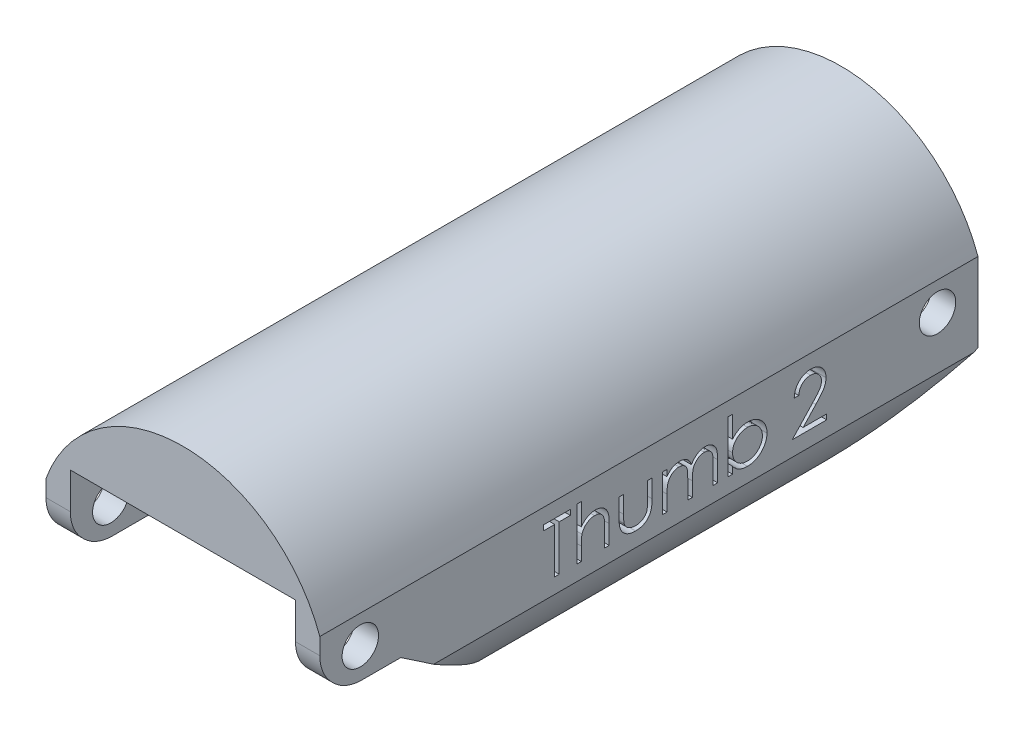
from build123d import *

# Parameters (mm, degrees)
BOSS_EXTRUDE1_DEPTH     = 20.6375
CUT_EXTRUDE1_DEPTH      = 30.060266989
CUT_EXTRUDE2_DEPTH      = 47.067541026
BOSS_EXTRUDE2_DEPTH     = 17.1704
SKETCH7_W               = 2.54
SKETCH7_H               = 2.8575
CUT_EXTRUDE3_DEPTH      = 2.54
SKETCH9_W               = 2.54
SKETCH9_H               = 3.81
CUT_EXTRUDE5_DEPTH      = 29.284043376
SKETCH11_W              = 2.54
SKETCH11_H              = 3.81
CUT_EXTRUDE8_DEPTH      = 3.81
CUT_EXTRUDE9_DEPTH      = 1.016
SKETCH13_W              = 3.556
SKETCH13_H              = 7.809132178
CUT_EXTRUDE10_DEPTH     = 3.81
SKETCH14_W              = 3.556
SKETCH14_H              = 6.35
CUT_EXTRUDE11_DEPTH     = 30.70423848
SKETCH10_R              = 0.889
CUT_EXTRUDE7_DEPTH      = 30.060266989
MIRROR4_COPY_1_SKETCH_W = 2.54
MIRROR4_COPY_1_SKETCH_H = 2.8575
MIRROR4_COPY_1_DEPTH    = 2.54
MIRROR4_COPY_2_SKETCH_W = 2.54
MIRROR4_COPY_2_SKETCH_H = 3.81
MIRROR4_COPY_2_DEPTH    = 29.284043376
MIRROR4_COPY_3_SKETCH_W = 2.54
MIRROR4_COPY_3_SKETCH_H = 3.81
MIRROR4_COPY_3_DEPTH    = 3.81
MIRROR4_COPY_4_DEPTH    = 1.016
MIRROR4_COPY_5_SKETCH_W = 3.556
MIRROR4_COPY_5_SKETCH_H = 7.809132178
MIRROR4_COPY_5_DEPTH    = 3.81
MIRROR4_COPY_6_SKETCH_W = 3.556
MIRROR4_COPY_6_SKETCH_H = 6.35
MIRROR4_COPY_6_DEPTH    = 30.70423848
CUT_EXTRUDE12_START     = -17.1704
CUT_EXTRUDE12_DEPTH     = 17.1704
SKETCH16_R              = 1.143
CUT_EXTRUDE13_DEPTH     = 30.060266989
CUT_EXTRUDE14_DEPTH     = 30.060266989
FILLET1_R               = 2.54
SKETCH21_W              = 14.1224
SKETCH21_H              = 7.62
CUT_EXTRUDE17_DEPTH     = 7.809132178
CUT_EXTRUDE18_START     = -1.184421
SKETCH22_W              = 7.0104
SKETCH22_H              = 2.54
CUT_EXTRUDE18_DEPTH     = 1.184421
SKETCH23_W              = 14.1224
SKETCH23_H              = 7.62
CUT_EXTRUDE19_DEPTH     = 0.1425
CUT_EXTRUDE20_DEPTH     = 16.51
SKETCH25_W              = 14.1224
SKETCH25_H              = 7.62
CUT_EXTRUDE21_DEPTH     = 6.623962162
CUT_EXTRUDE22_DEPTH     = 16.51
BOSS_EXTRUDE3_DEPTH     = 41.275
CUT_EXTRUDE24_START     = -33.382648
CUT_EXTRUDE24_DEPTH     = 33.858391
CUT_EXTRUDE23_DEPTH     = 1


with BuildPart() as part:
    # Sketch1 → Boss-Extrude1 (new, symmetric)
    with BuildSketch(Plane.XY):
        with BuildLine():
            Line((0, 0), (0, 5.08))
            ThreePointArc((0, 5.08), (8.5852, 11.1252), (17.1704, 5.08))
            Line((17.1704, 5.08), (17.1704, 0))
            ThreePointArc((17.1704, 0), (8.5852, -6.0452), (0, 0))
        make_face()
    extrude(amount=BOSS_EXTRUDE1_DEPTH, both=True)

    # Sketch2 → Cut-Extrude1 (cut, through all)
    with BuildSketch(Plane(origin=(0, 0, 0), x_dir=(0, 0, -1), z_dir=(1, 0, 0))):
        Polygon((-20.6375, -6.0452), (-20.6375, 0.635), (-3.81, -6.0452), align=None)
        Polygon((20.6375, 0.635), (20.6375, -6.0452), (6.31176487, -6.0452), align=None)
        with BuildLine():
            Line((-18.0975, 1.27), (-20.6375, 1.27))
            Line((-20.6375, 1.27), (-20.6375, 3.81))
            Line((-20.6375, 3.81), (-18.0975, 3.81))
            ThreePointArc((-18.0975, 3.81), (-13.357795474, 2.54), (-18.0975, 1.27))
        make_face()
        with BuildLine():
            Line((18.0975, 1.27), (20.6375, 1.27))
            Line((20.6375, 1.27), (20.6375, 3.81))
            Line((20.6375, 3.81), (18.0975, 3.81))
            ThreePointArc((18.0975, 3.81), (13.357795474, 2.54), (18.0975, 1.27))
        make_face()
    extrude(amount=CUT_EXTRUDE1_DEPTH, mode=Mode.SUBTRACT)

    # Sketch3 → Cut-Extrude2 (cut, through all)
    with BuildSketch(Plane.XY.offset(20.6375)):
        with BuildLine():
            ThreePointArc((5.545588702, -4.162727872), (8.5852, -1.905), (11.624811298, -4.162727872))
            ThreePointArc((11.624811298, -4.162727872), (8.5852, -4.7752), (5.545588702, -4.162727872))
        make_face()
    extrude(amount=-CUT_EXTRUDE2_DEPTH, mode=Mode.SUBTRACT)

    # Sketch4 → Boss-Extrude2 (add)
    with BuildSketch(Plane.ZY):
        with BuildLine():
            Line((20.6375, 1.27), (18.0975, 1.27))
            ThreePointArc((18.0975, 1.27), (17.167795474, 0.340295474), (15.897795474, 0))
            ThreePointArc((15.897795474, 0), (13.357795474, 2.54), (15.897795474, 5.08))
            ThreePointArc((15.897795474, 5.08), (17.167795474, 4.739704526), (18.0975, 3.81))
            Line((18.0975, 3.81), (20.6375, 3.81))
            Line((20.6375, 3.81), (20.6375, 1.27))
        make_face()
        with BuildLine():
            Line((-18.0975, 1.27), (-20.6375, 1.27))
            Line((-20.6375, 1.27), (-20.6375, 3.81))
            Line((-20.6375, 3.81), (-18.0975, 3.81))
            ThreePointArc((-18.0975, 3.81), (-17.167795474, 4.739704526), (-15.897795474, 5.08))
            ThreePointArc((-15.897795474, 5.08), (-13.357795474, 2.54), (-15.897795474, 0))
            ThreePointArc((-15.897795474, 0), (-17.167795474, 0.340295474), (-18.0975, 1.27))
        make_face()
    extrude(amount=-BOSS_EXTRUDE2_DEPTH)

    # Sketch7 → Cut-Extrude3 (cut)
    with BuildSketch(Plane.ZY.offset(-5.08)):
        with Locations((-19.3675, 1.42875)):
            Rectangle(SKETCH7_W, SKETCH7_H)
    cut_extrude3 = extrude(amount=CUT_EXTRUDE3_DEPTH, mode=Mode.SUBTRACT)

    # Sketch9 → Cut-Extrude5 (cut, through all)
    with BuildSketch(Plane.XZ.offset(-2.8575)):
        with Locations((3.81, -18.7325)):
            Rectangle(SKETCH9_W, SKETCH9_H)
    cut_extrude5 = extrude(amount=CUT_EXTRUDE5_DEPTH, mode=Mode.SUBTRACT)

    # Sketch11 → Cut-Extrude8 (cut)
    with BuildSketch(Plane.XZ.offset(-2.8575)):
        with Locations((3.81, -18.7325)):
            Rectangle(SKETCH11_W, SKETCH11_H)
    cut_extrude8 = extrude(amount=-CUT_EXTRUDE8_DEPTH, mode=Mode.SUBTRACT)

    # Sketch12 → Cut-Extrude9 (cut)
    with BuildSketch(Plane(origin=(2.54, 0, 0), x_dir=(0, 0, -1), z_dir=(1, 0, 0))):
        Polygon((16.8275, -1.141632178), (20.6375, 0.635), (20.6375, 6.6675), (16.8275, 6.6675), align=None)
    cut_extrude9 = extrude(amount=-CUT_EXTRUDE9_DEPTH, mode=Mode.SUBTRACT)

    # Sketch13 → Cut-Extrude10 (cut)
    with BuildSketch(Plane(origin=(0, 0, -16.8275), x_dir=(-1, 0, 0), z_dir=(0, 0, -1))):
        with Locations((-3.302, 2.762933911)):
            Rectangle(SKETCH13_W, SKETCH13_H)
    cut_extrude10 = extrude(amount=-CUT_EXTRUDE10_DEPTH, mode=Mode.SUBTRACT)

    # Sketch14 → Cut-Extrude11 (cut, through all)
    with BuildSketch(Plane.XZ.offset(-6.6675)):
        with Locations((3.302, -17.4625)):
            Rectangle(SKETCH14_W, SKETCH14_H)
    cut_extrude11 = extrude(amount=CUT_EXTRUDE11_DEPTH, mode=Mode.SUBTRACT)

    # Mirror3: Cut-Extrude3, Cut-Extrude5, Cut-Extrude8, Cut-Extrude9, Cut-Extrude10, Cut-Extrude11 across plane
    add(cut_extrude3.mirror(Plane(origin=(8.5852, 0, 0), x_dir=(0, 0, 1), z_dir=(1, 0, 0))), mode=Mode.SUBTRACT)
    add(cut_extrude5.mirror(Plane(origin=(8.5852, 0, 0), x_dir=(0, 0, 1), z_dir=(1, 0, 0))), mode=Mode.SUBTRACT)
    add(cut_extrude8.mirror(Plane(origin=(8.5852, 0, 0), x_dir=(0, 0, 1), z_dir=(1, 0, 0))), mode=Mode.SUBTRACT)
    add(cut_extrude9.mirror(Plane(origin=(8.5852, 0, 0), x_dir=(0, 0, 1), z_dir=(1, 0, 0))), mode=Mode.SUBTRACT)
    add(cut_extrude10.mirror(Plane(origin=(8.5852, 0, 0), x_dir=(0, 0, 1), z_dir=(1, 0, 0))), mode=Mode.SUBTRACT)
    add(cut_extrude11.mirror(Plane(origin=(8.5852, 0, 0), x_dir=(0, 0, 1), z_dir=(1, 0, 0))), mode=Mode.SUBTRACT)

    # Sketch10 → Cut-Extrude7 (cut, through all)
    with BuildSketch(Plane.ZY):
        with Locations((-18.0975, 3.81)):
            Circle(SKETCH10_R)
    cut_extrude7 = extrude(amount=-CUT_EXTRUDE7_DEPTH, mode=Mode.SUBTRACT)

    # Mirror4: Cut-Extrude3, Cut-Extrude5, Cut-Extrude8, Cut-Extrude9, Cut-Extrude10, Cut-Extrude11, Cut-Extrude7 across plane
    add(cut_extrude3.mirror(Plane(origin=(0, 0, 0), x_dir=(1, 0, 0), z_dir=(0, 0, -1))), mode=Mode.SUBTRACT)
    add(cut_extrude5.mirror(Plane(origin=(0, 0, 0), x_dir=(1, 0, 0), z_dir=(0, 0, -1))), mode=Mode.SUBTRACT)
    add(cut_extrude8.mirror(Plane(origin=(0, 0, 0), x_dir=(1, 0, 0), z_dir=(0, 0, -1))), mode=Mode.SUBTRACT)
    add(cut_extrude9.mirror(Plane(origin=(0, 0, 0), x_dir=(1, 0, 0), z_dir=(0, 0, -1))), mode=Mode.SUBTRACT)
    add(cut_extrude10.mirror(Plane(origin=(0, 0, 0), x_dir=(1, 0, 0), z_dir=(0, 0, -1))), mode=Mode.SUBTRACT)
    add(cut_extrude11.mirror(Plane(origin=(0, 0, 0), x_dir=(1, 0, 0), z_dir=(0, 0, -1))), mode=Mode.SUBTRACT)
    add(cut_extrude7.mirror(Plane(origin=(0, 0, 0), x_dir=(1, 0, 0), z_dir=(0, 0, -1))), mode=Mode.SUBTRACT)

    # Mirror4 copy 1 sketch → Mirror4 copy 1 (cut)
    with BuildSketch(Plane(origin=(12.0904, 0, 0), x_dir=(0, 0, -1), z_dir=(1, 0, 0))):
        with Locations((-19.3675, 1.42875)):
            Rectangle(MIRROR4_COPY_1_SKETCH_W, MIRROR4_COPY_1_SKETCH_H)
    extrude(amount=MIRROR4_COPY_1_DEPTH, mode=Mode.SUBTRACT)

    # Mirror4 copy 2 sketch → Mirror4 copy 2 (cut, through all)
    with BuildSketch(Plane(origin=(17.1704, 2.8575, 0), x_dir=(-1, 0, 0), z_dir=(0, -1, 0))):
        with Locations((3.81, -18.7325)):
            Rectangle(MIRROR4_COPY_2_SKETCH_W, MIRROR4_COPY_2_SKETCH_H)
    extrude(amount=MIRROR4_COPY_2_DEPTH, mode=Mode.SUBTRACT)

    # Mirror4 copy 3 sketch → Mirror4 copy 3 (cut)
    with BuildSketch(Plane(origin=(17.1704, 2.8575, 0), x_dir=(-1, 0, 0), z_dir=(0, -1, 0))):
        with Locations((3.81, -18.7325)):
            Rectangle(MIRROR4_COPY_3_SKETCH_W, MIRROR4_COPY_3_SKETCH_H)
    extrude(amount=-MIRROR4_COPY_3_DEPTH, mode=Mode.SUBTRACT)

    # Mirror4 copy 4 sketch → Mirror4 copy 4 (cut)
    with BuildSketch(Plane.ZY.offset(-14.6304)):
        Polygon((16.8275, -1.141632178), (20.6375, 0.635), (20.6375, 6.6675), (16.8275, 6.6675), align=None)
    extrude(amount=-MIRROR4_COPY_4_DEPTH, mode=Mode.SUBTRACT)

    # Mirror4 copy 5 sketch → Mirror4 copy 5 (cut)
    with BuildSketch(Plane(origin=(17.1704, 0, 16.8275), x_dir=(1, 0, 0), z_dir=(0, 0, 1))):
        with Locations((-3.302, 2.762933911)):
            Rectangle(MIRROR4_COPY_5_SKETCH_W, MIRROR4_COPY_5_SKETCH_H)
    extrude(amount=-MIRROR4_COPY_5_DEPTH, mode=Mode.SUBTRACT)

    # Mirror4 copy 6 sketch → Mirror4 copy 6 (cut, through all)
    with BuildSketch(Plane(origin=(17.1704, 6.6675, 0), x_dir=(-1, 0, 0), z_dir=(0, -1, 0))):
        with Locations((3.302, -17.4625)):
            Rectangle(MIRROR4_COPY_6_SKETCH_W, MIRROR4_COPY_6_SKETCH_H)
    extrude(amount=MIRROR4_COPY_6_DEPTH, mode=Mode.SUBTRACT)

    # Sketch15 → Cut-Extrude12 (cut)
    with BuildSketch(Plane.ZY.offset(CUT_EXTRUDE12_START)):
        Polygon((15.5575, 1.905), (20.6375, 1.905), (20.6375, -6.0452), (3.81, -6.0452), align=None)
    cut_extrude12 = extrude(amount=CUT_EXTRUDE12_DEPTH, mode=Mode.SUBTRACT)

    # Mirror5: Cut-Extrude12 across plane
    add(cut_extrude12.mirror(Plane(origin=(8.5852, 0, 0), x_dir=(0, 0, 1), z_dir=(1, 0, 0))), mode=Mode.SUBTRACT)

    # Sketch16 → Cut-Extrude13 (cut, through all)
    with BuildSketch(Plane(origin=(17.1704, 0, 0), x_dir=(0, 0, -1), z_dir=(1, 0, 0))):
        with Locations((-18.0975, 3.81)):
            Circle(SKETCH16_R)
        with Locations((18.0975, 3.81)):
            Circle(SKETCH16_R)
    extrude(amount=-CUT_EXTRUDE13_DEPTH, mode=Mode.SUBTRACT)

    # Sketch17 → Cut-Extrude14 (cut, through all)
    with BuildSketch(Plane(origin=(17.1704, 0, 0), x_dir=(0, 0, -1), z_dir=(1, 0, 0))):
        Polygon((-20.6375, 3.4925), (-19.05, 1.905), (-20.6375, 1.905), align=None)
    extrude(amount=-CUT_EXTRUDE14_DEPTH, mode=Mode.SUBTRACT)

    # Fillet1
    fillet1_edges = [part.edges().sort_by_distance(p)[0] for p in [
        (16.4084, 1.905, 19.05),
        (0.762, 1.905, 19.05),
        (0.762, 3.4925, 20.6375),
        (16.4084, 3.4925, 20.6375),
    ]]
    fillet(fillet1_edges, radius=FILLET1_R)

    # Sketch21 → Cut-Extrude17 (cut)
    with BuildSketch(Plane(origin=(0, -1.141632178, 0), x_dir=(1, 0, 0), z_dir=(0, 1, 0))):
        with Locations((8.5852, 16.8275)):
            Rectangle(SKETCH21_W, SKETCH21_H)
    extrude(amount=CUT_EXTRUDE17_DEPTH, mode=Mode.SUBTRACT)

    # Sketch22 → Cut-Extrude18 (cut)
    with BuildSketch(Plane(origin=(0, -1.141632178, 0), x_dir=(1, 0, 0), z_dir=(0, 1, 0)).offset(CUT_EXTRUDE18_START)):
        with Locations((8.5852, 15.5575)):
            Rectangle(SKETCH22_W, SKETCH22_H)
    extrude(amount=CUT_EXTRUDE18_DEPTH, mode=Mode.SUBTRACT)

    # Sketch23 → Cut-Extrude19 (cut)
    with BuildSketch(Plane.XZ.offset(-6.6675)):
        with Locations((8.5852, -16.8275)):
            Rectangle(SKETCH23_W, SKETCH23_H)
    extrude(amount=-CUT_EXTRUDE19_DEPTH, mode=Mode.SUBTRACT)

    # Sketch24 → Cut-Extrude20 (cut)
    with BuildSketch(Plane(origin=(0, 0, -13.0175), x_dir=(-1, 0, 0), z_dir=(0, 0, -1))):
        with BuildLine():
            Line((-6.604, 6.2636968), (-5.588, 6.2636968))
            ThreePointArc((-5.588, 6.2636968), (-5.207, 5.8826968), (-5.588, 5.5016968))
            Line((-5.588, 5.5016968), (-6.604, 5.5016968))
            ThreePointArc((-6.604, 5.5016968), (-6.985, 5.8826968), (-6.604, 6.2636968))
        make_face()
    extrude(amount=-CUT_EXTRUDE20_DEPTH, mode=Mode.SUBTRACT)

    # Sketch25 → Cut-Extrude21 (cut)
    with BuildSketch(Plane(origin=(0, 0.186037838, 0), x_dir=(-1, 0, 0), z_dir=(0, -1, 0))):
        with Locations((-8.5852, -16.8275)):
            Rectangle(SKETCH25_W, SKETCH25_H)
    extrude(amount=-CUT_EXTRUDE21_DEPTH, mode=Mode.SUBTRACT)

    # Sketch26 → Cut-Extrude22 (cut)
    with BuildSketch(Plane.XY.offset(13.0175)):
        with BuildLine():
            Line((11.7094, 5.5016968), (10.6934, 5.5016968))
            ThreePointArc((10.6934, 5.5016968), (10.3124, 5.8826968), (10.6934, 6.2636968))
            Line((10.6934, 6.2636968), (11.7094, 6.2636968))
            ThreePointArc((11.7094, 6.2636968), (12.0904, 5.8826968), (11.7094, 5.5016968))
        make_face()
    extrude(amount=-CUT_EXTRUDE22_DEPTH, mode=Mode.SUBTRACT)

    # Sketch28 → Boss-Extrude3 (add)
    with BuildSketch(Plane.XY.offset(20.6375)):
        with BuildLine():
            Line((17.1704, 5.08), (17.1704, 5.588))
            ThreePointArc((17.1704, 5.588), (16.377038219, 7.251475938), (15.2654, 8.721454027))
            ThreePointArc((15.2654, 8.721454027), (8.5852, 11.6332), (1.905, 8.721454027))
            ThreePointArc((1.905, 8.721454027), (0.793361781, 7.251475938), (0, 5.588))
            Line((0, 5.588), (0, 5.08))
            ThreePointArc((0, 5.08), (8.5852, 11.1252), (17.1704, 5.08))
        make_face()
    extrude(amount=-BOSS_EXTRUDE3_DEPTH)

    # Sketch29 → Cut-Extrude24 (cut)
    with BuildSketch(Plane.XY.offset(13.0175).offset(CUT_EXTRUDE24_START)):
        with BuildLine():
            Line((0, 0), (0, 0.508))
            ThreePointArc((0, 0.508), (0.793361781, -1.155475938), (1.905, -2.625454027))
            ThreePointArc((1.905, -2.625454027), (8.5852, -5.5372), (15.2654, -2.625454027))
            ThreePointArc((15.2654, -2.625454027), (16.377038219, -1.155475938), (17.1704, 0.508))
            Line((17.1704, 0.508), (17.1704, 0))
            ThreePointArc((17.1704, 0), (8.5852, -6.0452), (0, 0))
        make_face()
    extrude(amount=CUT_EXTRUDE24_DEPTH, mode=Mode.SUBTRACT)

    # Sketch27 → Cut-Extrude23 (cut)
    # profile 1 of 6: a face of its own
    with BuildSketch(Plane(origin=(17.1704, 0, 0), x_dir=(0, 0, -1), z_dir=(1, 0, 0))):
        Polygon((-6.599270706, 4.310775781), (-6.599270706, 4.636416806), (-4.930360449, 4.636416806), (-4.930360449, 4.310775781), (-5.622347629, 4.310775781), (-5.622347629, 1.461416806), (-5.907283526, 1.461416806), (-5.907283526, 4.310775781), align=None)
    # profile 2 of 6: a face of its own
    with BuildSketch(Plane(origin=(17.1704, 0, 0), x_dir=(0, 0, -1), z_dir=(1, 0, 0))):
        with BuildLine():
            Line((-4.523309167, 4.717827063), (-4.23837327, 4.717827063))
            Line((-4.23837327, 4.717827063), (-4.23837327, 3.343392968))
            add(Edge.make_bspline(
                [(-4.23837327, 3.343392968), (-4.207786861, 3.38162358), (-4.148233554, 3.456060542), (-4.047997791, 3.553180336), (-3.9450635, 3.637361943), (-3.835875423, 3.704373), (-3.722436736, 3.757310722), (-3.604269002, 3.794855229), (-3.481350264, 3.81794301), (-3.397870306, 3.820844432), (-3.355580802, 3.822314242)],
                knots=[0, 0, 0, 0, 1.125788106, 2.19196713, 3.20547328, 4.180437432, 5.132270164, 6.079753143, 7.027236121, 8, 8, 8, 8], degree=3))
            add(Edge.make_bspline(
                [(-3.355580802, 3.822314242), (-3.312645374, 3.820730887), (-3.228610385, 3.817631881), (-3.10625363, 3.793126885), (-2.991989122, 3.751255495), (-2.886156536, 3.693953979), (-2.791065561, 3.622586486), (-2.70683756, 3.540189319), (-2.638039121, 3.444690836), (-2.591231351, 3.35646552), (-2.560775474, 3.277962507), (-2.541497031, 3.210619386), (-2.525151044, 3.135578793), (-2.510909141, 3.052879357), (-2.501417178, 2.962124094), (-2.493792989, 2.863722449), (-2.488371491, 2.757680064), (-2.488161393, 2.684273837), (-2.488052757, 2.646317648)],
                knots=[0, 0, 0, 0, 1.235656852, 2.418478516, 3.575258207, 4.727955599, 5.870717718, 6.98870536, 8.107142894, 9.245821548, 9.854588956, 10.528768408, 11.260415777, 12.065282286, 12.943670737, 13.886611085, 14.907229059, 16, 16, 16, 16], degree=3))
            Line((-2.488052757, 2.646317648), (-2.488052757, 1.461416806))
            Line((-2.488052757, 1.461416806), (-2.772988654, 1.461416806))
            Line((-2.772988654, 1.461416806), (-2.772988654, 2.552823056))
            add(Edge.make_bspline(
                [(-2.772988654, 2.552823056), (-2.773161287, 2.584412192), (-2.773491503, 2.644836833), (-2.774583108, 2.731347517), (-2.777019889, 2.809811868), (-2.780957638, 2.879978417), (-2.785099024, 2.941944986), (-2.79079889, 2.995621585), (-2.797430317, 3.041081938), (-2.80338914, 3.068445566), (-2.806061571, 3.080717688)],
                knots=[0, 0, 0, 0, 1.430932559, 2.737130458, 3.918967929, 4.986496826, 5.920444988, 6.731744033, 7.431208747, 8, 8, 8, 8], degree=3))
            add(Edge.make_bspline(
                [(-2.806061571, 3.080717688), (-2.816424993, 3.116726055), (-2.836348613, 3.185951933), (-2.88265642, 3.279988547), (-2.940494952, 3.360166134), (-3.011113539, 3.425402667), (-3.093262912, 3.476575992), (-3.187478737, 3.512016051), (-3.292874285, 3.534012199), (-3.367125263, 3.536224996), (-3.405826195, 3.537378345)],
                knots=[0, 0, 0, 0, 1.090059168, 2.095632401, 3.037101401, 3.955032261, 4.878929692, 5.839099886, 6.873700383, 8, 8, 8, 8], degree=3))
            add(Edge.make_bspline(
                [(-3.405826195, 3.537378345), (-3.428747675, 3.536946702), (-3.474108691, 3.536092493), (-3.541372124, 3.527516456), (-3.60662206, 3.513502262), (-3.670486893, 3.494538859), (-3.731613079, 3.468734693), (-3.791782345, 3.438862307), (-3.849289949, 3.402296962), (-3.905157083, 3.36127073), (-3.957152274, 3.315850305), (-4.005527586, 3.267910567), (-4.048651652, 3.216861135), (-4.087721016, 3.16352103), (-4.121447033, 3.107158618), (-4.150886614, 3.048317414), (-4.175865424, 2.986920039), (-4.188277581, 2.944306948), (-4.194488054, 2.922985316)],
                knots=[0, 0, 0, 0, 1.024319606, 2.027102035, 3.025350316, 4.005802111, 5.00026367, 5.987881639, 7.005602596, 8.042517216, 9.083927026, 10.089214625, 11.084353441, 12.06828073, 13.041928858, 14.016821737, 15.00770877, 16, 16, 16, 16], degree=3))
            add(Edge.make_bspline(
                [(-4.194488054, 2.922985316), (-4.198061677, 2.907544882), (-4.205849042, 2.873898276), (-4.214298926, 2.818404425), (-4.221862499, 2.75391893), (-4.22825654, 2.6805396), (-4.232178197, 2.597997544), (-4.236403887, 2.506856031), (-4.237976886, 2.406544155), (-4.238237193, 2.336788945), (-4.23837327, 2.300324058)],
                knots=[0, 0, 0, 0, 0.607992626, 1.324890765, 2.152360218, 3.099583803, 4.150613268, 5.323148443, 6.60066238, 8, 8, 8, 8], degree=3))
            Line((-4.23837327, 2.300324058), (-4.23837327, 1.461416806))
            Line((-4.23837327, 1.461416806), (-4.523309167, 1.461416806))
            Line((-4.523309167, 1.461416806), (-4.523309167, 4.717827063))
        make_face()
    # profile 3 of 6: a face of its own
    with BuildSketch(Plane(origin=(17.1704, 0, 0), x_dir=(0, 0, -1), z_dir=(1, 0, 0))):
        with BuildLine():
            Line((-1.877475834, 3.781609114), (-1.592539937, 3.781609114))
            Line((-1.592539937, 3.781609114), (-1.592539937, 2.705467287))
            add(Edge.make_bspline(
                [(-1.592539937, 2.705467287), (-1.592411209, 2.673878079), (-1.592164958, 2.613449403), (-1.590494961, 2.526495055), (-1.586566948, 2.447195609), (-1.581655836, 2.375505255), (-1.575340184, 2.311436121), (-1.567825992, 2.25521199), (-1.559427281, 2.206195266), (-1.551206105, 2.176673793), (-1.547382685, 2.16294425)],
                knots=[0, 0, 0, 0, 1.388932606, 2.656963016, 3.823490214, 4.879454478, 5.816252168, 6.653371382, 7.373723809, 8, 8, 8, 8], degree=3))
            add(Edge.make_bspline(
                [(-1.547382685, 2.16294425), (-1.541249079, 2.145687789), (-1.529109384, 2.111533623), (-1.507089867, 2.062195026), (-1.479849876, 2.016497448), (-1.450041318, 1.972678753), (-1.415661141, 1.932036951), (-1.377144335, 1.894640673), (-1.33578022, 1.859076962), (-1.274316734, 1.816999329), (-1.190261543, 1.771900422), (-1.079905115, 1.732987787), (-0.960249139, 1.709732436), (-0.877549715, 1.707034362), (-0.835042941, 1.705647575)],
                knots=[0, 0, 0, 0, 0.725840625, 1.436591201, 2.137033971, 2.831655856, 3.53531722, 4.242432219, 4.957935707, 5.694543706, 7.190802206, 8.724350549, 10.316345118, 12, 12, 12, 12], degree=3))
            add(Edge.make_bspline(
                [(-0.835042941, 1.705647575), (-0.792540116, 1.707063851), (-0.710305015, 1.709804082), (-0.591963721, 1.732286292), (-0.483785652, 1.769847167), (-0.386856575, 1.822286748), (-0.301616134, 1.886459905), (-0.23058284, 1.961760753), (-0.171974831, 2.045806982), (-0.146384856, 2.108512578), (-0.133515497, 2.140047615)],
                knots=[0, 0, 0, 0, 1.157059328, 2.238695713, 3.266970494, 4.264342957, 5.228770407, 6.160125903, 7.074715775, 8, 8, 8, 8], degree=3))
            add(Edge.make_bspline(
                [(-0.133515497, 2.140047615), (-0.129710732, 2.152717044), (-0.121299324, 2.180726055), (-0.112262048, 2.228241969), (-0.104120929, 2.284906289), (-0.097169333, 2.351089807), (-0.09221165, 2.426619567), (-0.089539183, 2.511471965), (-0.086519962, 2.605380627), (-0.086474136, 2.671119237), (-0.086450193, 2.705467287)],
                knots=[0, 0, 0, 0, 0.557542046, 1.232589297, 2.036731608, 2.971723315, 4.038036528, 5.22795436, 6.551621927, 8, 8, 8, 8], degree=3))
            Line((-0.086450193, 2.705467287), (-0.086450193, 3.781609114))
            Line((-0.086450193, 3.781609114), (0.198485704, 3.781609114))
            Line((0.198485704, 3.781609114), (0.198485704, 2.652041806))
            add(Edge.make_bspline(
                [(0.198485704, 2.652041806), (0.198085024, 2.613663158), (0.19730765, 2.53920333), (0.192311702, 2.4309956), (0.183739554, 2.330155564), (0.170728689, 2.236629843), (0.155429113, 2.150489842), (0.135693066, 2.071625159), (0.112127093, 2.000278778), (0.085542804, 1.935198737), (0.054135824, 1.876191912), (0.020728456, 1.820188707), (-0.017847587, 1.768578687), (-0.058460586, 1.718792748), (-0.103637802, 1.67330722), (-0.152532674, 1.631078381), (-0.204457005, 1.591460702), (-0.260563063, 1.555999327), (-0.320031777, 1.524052799), (-0.382936562, 1.495735357), (-0.450047896, 1.47332659), (-0.520499909, 1.453994772), (-0.594637774, 1.438832361), (-0.672390016, 1.428140261), (-0.753730446, 1.421585854), (-0.809165456, 1.421007963), (-0.837587012, 1.420711678)],
                knots=[0, 0, 0, 0, 1.493040784, 2.896703357, 4.213163133, 5.428574705, 6.569057535, 7.615249723, 8.588095153, 9.490268104, 10.346124644, 11.18633936, 12.024365274, 12.850166724, 13.684164916, 14.514361689, 15.362232829, 16.222528818, 17.093394965, 17.986930858, 18.902426812, 19.842810585, 20.827885679, 21.843828298, 22.894529745, 24, 24, 24, 24], degree=3))
            add(Edge.make_bspline(
                [(-0.837587012, 1.420711678), (-0.865795993, 1.421019841), (-0.921229266, 1.42162541), (-1.002573894, 1.42810405), (-1.080541559, 1.438815747), (-1.154855063, 1.454105837), (-1.22558898, 1.473191279), (-1.293029827, 1.495873058), (-1.356387916, 1.524067495), (-1.416424448, 1.555797136), (-1.472669472, 1.591688493), (-1.525382253, 1.631029501), (-1.574492112, 1.673761429), (-1.620009881, 1.719705818), (-1.661296653, 1.76943261), (-1.698866919, 1.822541797), (-1.733299073, 1.878507148), (-1.764461962, 1.938435874), (-1.79123334, 2.004269055), (-1.81486917, 2.077109993), (-1.834200963, 2.157757276), (-1.84993306, 2.246141954), (-1.862589009, 2.341841027), (-1.871375724, 2.44540809), (-1.876288656, 2.556590868), (-1.877071576, 2.633380411), (-1.877475834, 2.673030388)],
                knots=[0, 0, 0, 0, 1.083640291, 2.129454052, 3.13281866, 4.105697902, 5.042300162, 5.946461698, 6.836384745, 7.703652036, 8.553297018, 9.397182691, 10.228592656, 11.052265423, 11.879314572, 12.708807002, 13.549817954, 14.402308542, 15.300838682, 16.27712199, 17.341985831, 18.484375296, 19.725102775, 21.0496083, 22.476576903, 24, 24, 24, 24], degree=3))
            Line((-1.877475834, 2.673030388), (-1.877475834, 3.781609114))
        make_face()
    # profile 4 of 6: a face of its own
    with BuildSketch(Plane(origin=(17.1704, 0, 0), x_dir=(0, 0, -1), z_dir=(1, 0, 0))):
        with BuildLine():
            Line((0.849767756, 3.781609114), (1.134703653, 3.781609114))
            Line((1.134703653, 3.781609114), (1.134703653, 3.378373938))
            add(Edge.make_bspline(
                [(1.134703653, 3.378373938), (1.160361236, 3.413650548), (1.209523625, 3.481243915), (1.290137467, 3.57031653), (1.370670084, 3.64590707), (1.428666794, 3.685588104), (1.456528573, 3.704650981)],
                knots=[0, 0, 0, 0, 1.134379233, 2.173579362, 3.122582517, 4, 4, 4, 4], degree=3))
            add(Edge.make_bspline(
                [(1.456528573, 3.704650981), (1.494505802, 3.722798705), (1.569796754, 3.758777091), (1.689012765, 3.795274677), (1.811000501, 3.817703876), (1.893376524, 3.820771265), (1.934813829, 3.822314242)],
                knots=[0, 0, 0, 0, 1.014936303, 2.012140481, 3.000054389, 4, 4, 4, 4], degree=3))
            add(Edge.make_bspline(
                [(1.934813829, 3.822314242), (1.962838191, 3.821366014), (2.018296895, 3.819489522), (2.100469605, 3.807279347), (2.180169917, 3.786173604), (2.256926929, 3.756775532), (2.329244974, 3.72117318), (2.395547318, 3.679399516), (2.455077849, 3.632502884), (2.507806482, 3.578365566), (2.555221955, 3.515467366), (2.598836337, 3.44211194), (2.639136351, 3.356652133), (2.661471396, 3.294633914), (2.673230296, 3.261982712)],
                knots=[0, 0, 0, 0, 1.009824226, 1.998387844, 2.986035974, 3.974953746, 4.955485308, 5.885931332, 6.793869504, 7.679848016, 8.601185859, 9.625726857, 10.749998409, 12, 12, 12, 12], degree=3))
            add(Edge.make_bspline(
                [(2.673230296, 3.261982712), (2.68566836, 3.284411292), (2.710144722, 3.328547588), (2.751243407, 3.391011869), (2.79430348, 3.44943803), (2.839691913, 3.50387243), (2.887248502, 3.554046256), (2.937197058, 3.600125396), (2.989253253, 3.642307732), (3.061636213, 3.691586599), (3.155809079, 3.743929813), (3.274543297, 3.789312759), (3.398050953, 3.817358104), (3.481887008, 3.82065128), (3.524221882, 3.822314242)],
                knots=[0, 0, 0, 0, 0.86119277, 1.694706429, 2.50939023, 3.298075842, 4.073795165, 4.829715201, 5.57930267, 6.321991688, 7.768977793, 9.186738141, 10.579381044, 12, 12, 12, 12], degree=3))
            add(Edge.make_bspline(
                [(3.524221882, 3.822314242), (3.563121495, 3.820847192), (3.639251814, 3.817976032), (3.750084048, 3.795430381), (3.853445543, 3.756715658), (3.949128319, 3.703889431), (4.035451864, 3.637505457), (4.110487373, 3.558521583), (4.17377906, 3.467496489), (4.215125397, 3.381869471), (4.243169958, 3.306272419), (4.260461221, 3.241859569), (4.27573723, 3.170964946), (4.288420217, 3.09350378), (4.297689903, 3.009202443), (4.304557624, 2.918198891), (4.309205891, 2.820422397), (4.309534342, 2.752962265), (4.309703653, 2.71818764)],
                knots=[0, 0, 0, 0, 1.209669288, 2.367440248, 3.500751976, 4.631527125, 5.755587489, 6.87532382, 8.007944318, 9.190864318, 9.82315674, 10.514484317, 11.263564316, 12.079023757, 12.955305781, 13.901327259, 14.918167583, 16, 16, 16, 16], degree=3))
            Line((4.309703653, 2.71818764), (4.309703653, 1.461416806))
            Line((4.309703653, 1.461416806), (4.024767756, 1.461416806))
            Line((4.024767756, 1.461416806), (4.024767756, 2.719459675))
            add(Edge.make_bspline(
                [(4.024767756, 2.719459675), (4.024697105, 2.74914191), (4.024561324, 2.806186651), (4.022117816, 2.888058518), (4.017513781, 2.96268767), (4.012130216, 3.02997235), (4.004651903, 3.090069465), (3.994994522, 3.142858302), (3.984764055, 3.188754117), (3.967767835, 3.239632174), (3.940600819, 3.295757294), (3.899219248, 3.356285109), (3.847085651, 3.408972692), (3.786887509, 3.454709308), (3.718354277, 3.491896397), (3.642821278, 3.51845392), (3.56075746, 3.534893959), (3.503949645, 3.536532274), (3.474612507, 3.537378345)],
                knots=[0, 0, 0, 0, 1.253487763, 2.409012846, 3.458416907, 4.410876679, 5.259312806, 6.014470957, 6.676830364, 7.243083969, 8.276244668, 9.299465089, 10.325150304, 11.392391894, 12.482080715, 13.603491619, 14.762376348, 16, 16, 16, 16], degree=3))
            add(Edge.make_bspline(
                [(3.474612507, 3.537378345), (3.438626192, 3.536093688), (3.367503551, 3.533554717), (3.263685145, 3.507634132), (3.163925723, 3.46855419), (3.071201995, 3.411919033), (2.985905357, 3.34405716), (2.912517883, 3.26336717), (2.851891543, 3.17208145), (2.810839722, 3.087584084), (2.784905141, 3.011683946), (2.767781082, 2.945374187), (2.754461148, 2.870007336), (2.741969311, 2.786089827), (2.733816158, 2.69304402), (2.726406277, 2.591300328), (2.722940209, 2.480552736), (2.722455379, 2.40378424), (2.722203653, 2.363925821)],
                knots=[0, 0, 0, 0, 1.090531906, 2.155305635, 3.229839962, 4.33261226, 5.44038871, 6.529323825, 7.629011124, 8.757537029, 9.370236727, 10.061839251, 10.834451254, 11.692844982, 12.636905849, 13.66920014, 14.789842145, 16, 16, 16, 16], degree=3))
            Line((2.722203653, 2.363925821), (2.722203653, 1.461416806))
            Line((2.722203653, 1.461416806), (2.437267756, 1.461416806))
            Line((2.437267756, 1.461416806), (2.437267756, 2.641229507))
            add(Edge.make_bspline(
                [(2.437267756, 2.641229507), (2.437195701, 2.674515589), (2.437057073, 2.738554665), (2.434629271, 2.83038807), (2.430014979, 2.913918764), (2.424680481, 2.989049664), (2.417005891, 3.055644226), (2.408288464, 3.114059471), (2.397993653, 3.164148952), (2.380948543, 3.219088594), (2.354900418, 3.279614003), (2.313001066, 3.344149072), (2.260742761, 3.400635132), (2.199446324, 3.448857711), (2.130498312, 3.488718912), (2.05431337, 3.51743883), (1.971577485, 3.534152292), (1.914538423, 3.536282714), (1.885204454, 3.537378345)],
                knots=[0, 0, 0, 0, 1.320475261, 2.540461679, 3.643808994, 4.639130445, 5.527981419, 6.302341397, 6.981980563, 7.553956391, 8.582137848, 9.585246428, 10.591171744, 11.620968678, 12.668337649, 13.738356861, 14.836885341, 16, 16, 16, 16], degree=3))
            add(Edge.make_bspline(
                [(1.885204454, 3.537378345), (1.85071832, 3.535989999), (1.781988678, 3.533223075), (1.681021891, 3.508318126), (1.583517021, 3.469307287), (1.491029544, 3.415187308), (1.40605371, 3.348150287), (1.331660496, 3.26930606), (1.269119776, 3.179635865), (1.227634487, 3.096029483), (1.200875157, 3.022030869), (1.183099389, 2.959119652), (1.167823443, 2.889269427), (1.156471437, 2.81226469), (1.145512775, 2.728606984), (1.140223852, 2.637879554), (1.135078934, 2.540160231), (1.134831815, 2.472693708), (1.134703653, 2.437703865)],
                knots=[0, 0, 0, 0, 1.098833095, 2.189935336, 3.297829714, 4.440610912, 5.596351641, 6.740013378, 7.886572111, 9.072425424, 9.705826452, 10.395263256, 11.156850408, 11.985370555, 12.878090359, 13.847760091, 14.883794034, 16, 16, 16, 16], degree=3))
            Line((1.134703653, 2.437703865), (1.134703653, 1.461416806))
            Line((1.134703653, 1.461416806), (0.849767756, 1.461416806))
            Line((0.849767756, 1.461416806), (0.849767756, 3.781609114))
        make_face()
    # profile 5 of 6: a face of its own
    with BuildSketch(Plane(origin=(17.1704, 0, 0), x_dir=(0, 0, -1), z_dir=(1, 0, 0))):
        with BuildLine():
            Line((4.960985704, 1.461416806), (4.960985704, 4.717827063))
            Line((4.960985704, 4.717827063), (5.245921602, 4.717827063))
            Line((5.245921602, 4.717827063), (5.245921602, 3.360565444))
            add(Edge.make_bspline(
                [(5.245921602, 3.360565444), (5.278028489, 3.397538711), (5.34067035, 3.469675078), (5.44569613, 3.563879732), (5.555828326, 3.643755908), (5.671904743, 3.709601887), (5.794090476, 3.759742945), (5.921754603, 3.796411827), (6.055223476, 3.818534232), (6.146227298, 3.821043455), (6.192315833, 3.822314242)],
                knots=[0, 0, 0, 0, 1.077089805, 2.101446609, 3.097517232, 4.067117542, 5.031729543, 5.997785507, 6.985986182, 8, 8, 8, 8], degree=3))
            add(Edge.make_bspline(
                [(6.192315833, 3.822314242), (6.233287972, 3.821189178), (6.314296874, 3.818964734), (6.433388536, 3.802060585), (6.547972721, 3.774648722), (6.657987059, 3.736646531), (6.762918208, 3.68622483), (6.863664638, 3.625862358), (6.959710188, 3.553981873), (7.04956712, 3.471796263), (7.132383717, 3.382572755), (7.20487578, 3.287159184), (7.266107647, 3.186942494), (7.316754605, 3.082258152), (7.355916918, 2.972678605), (7.382897403, 2.858311296), (7.400036474, 2.739268736), (7.402195697, 2.658249265), (7.403293397, 2.617060837)],
                knots=[0, 0, 0, 0, 1.034377878, 2.045141349, 3.03070803, 4.00595497, 4.978199603, 5.965204761, 6.967410914, 8.002051993, 9.036360596, 10.037508045, 11.022711142, 11.997267194, 12.969246472, 13.954813154, 14.960274251, 16, 16, 16, 16], degree=3))
            add(Edge.make_bspline(
                [(7.403293397, 2.617060837), (7.402171769, 2.576511535), (7.399960094, 2.496554698), (7.383067908, 2.378892322), (7.355176653, 2.265645787), (7.31529758, 2.157107725), (7.265164386, 2.052768233), (7.202470586, 1.953816723), (7.130070607, 1.858531367), (7.046313066, 1.769972787), (6.9556772, 1.688118202), (6.858690708, 1.616992882), (6.757796536, 1.55556378), (6.651422142, 1.506890624), (6.541142561, 1.467519788), (6.425776317, 1.44019874), (6.305976103, 1.424257469), (6.224588255, 1.421902919), (6.183411586, 1.420711678)],
                knots=[0, 0, 0, 0, 1.024244038, 2.01964794, 2.996620209, 3.965911562, 4.936179293, 5.91563013, 6.920572822, 7.955171681, 8.990768464, 10.002129126, 10.989675881, 11.969873457, 12.952483066, 13.943799762, 14.959703725, 16, 16, 16, 16], degree=3))
            add(Edge.make_bspline(
                [(6.183411586, 1.420711678), (6.136271805, 1.422018515), (6.043838915, 1.424580996), (5.908626855, 1.445825356), (5.780645735, 1.481985531), (5.658437673, 1.530573695), (5.543749667, 1.596367545), (5.435853568, 1.677971169), (5.335429794, 1.776729214), (5.276268826, 1.852077851), (5.245921602, 1.890728705)],
                knots=[0, 0, 0, 0, 1.035807596, 2.031038093, 2.998900396, 3.954262848, 4.914341711, 5.895762244, 6.92060972, 8, 8, 8, 8], degree=3))
            Line((5.245921602, 1.890728705), (5.245921602, 1.461416806))
            Line((5.245921602, 1.461416806), (4.960985704, 1.461416806))
        make_face()
        with BuildLine():
            add(Edge.make_bspline(
                [(6.180867515, 1.705647575), (6.222518392, 1.70712951), (6.304730598, 1.710054614), (6.425420323, 1.732890686), (6.540912498, 1.770885561), (6.650625152, 1.822850068), (6.752841385, 1.888184342), (6.844147703, 1.967238368), (6.925318582, 2.057500456), (6.993038407, 2.15931245), (7.049577215, 2.267671543), (7.088414973, 2.381657945), (7.114467863, 2.498221075), (7.117055305, 2.577274987), (7.118357499, 2.617060837)],
                knots=[0, 0, 0, 0, 1.031910345, 2.036826888, 3.032245421, 4.038315463, 5.03827337, 6.029480047, 7.023177075, 8.037597977, 9.052889626, 10.043399556, 11.015292101, 12, 12, 12, 12], degree=3))
            add(Edge.make_bspline(
                [(7.118357499, 2.617060837), (7.116645046, 2.656807793), (7.113226976, 2.736143024), (7.08930128, 2.853753794), (7.047520285, 2.96767971), (6.992077507, 3.077605457), (6.923254406, 3.180119676), (6.842513282, 3.27218572), (6.750091929, 3.351615134), (6.64774497, 3.417827556), (6.538724369, 3.471856579), (6.423979294, 3.508908852), (6.305907282, 3.533164208), (6.225719942, 3.535966488), (6.185319639, 3.537378345)],
                knots=[0, 0, 0, 0, 0.984795267, 1.965658976, 2.959410029, 3.983795688, 5.009594896, 6.01088574, 7.009236619, 8.019050059, 9.024672985, 10.014834719, 10.999826153, 12, 12, 12, 12], degree=3))
            add(Edge.make_bspline(
                [(6.185319639, 3.537378345), (6.144074114, 3.535967286), (6.062210117, 3.533166622), (5.941407515, 3.508866238), (5.823421536, 3.471630191), (5.71067499, 3.418171038), (5.605578811, 3.352755642), (5.51158737, 3.275884175), (5.430550885, 3.188090973), (5.363836179, 3.08966071), (5.310854683, 2.983357142), (5.272950854, 2.869953215), (5.250272603, 2.750045881), (5.247389583, 2.667828616), (5.245921602, 2.625965083)],
                knots=[0, 0, 0, 0, 1.016820015, 2.018181405, 3.029022337, 4.06341356, 5.088169224, 6.076823655, 7.05054209, 8.02560866, 9.001194327, 9.972267242, 10.967515442, 12, 12, 12, 12], degree=3))
            add(Edge.make_bspline(
                [(5.245921602, 2.625965083), (5.24679216, 2.593908634), (5.248505694, 2.530811397), (5.2615961, 2.438166992), (5.282420165, 2.349509115), (5.311760334, 2.264741155), (5.350315025, 2.184344313), (5.396770052, 2.107694298), (5.452061903, 2.035482752), (5.514570023, 1.967886712), (5.583478754, 1.906373886), (5.657431869, 1.853053639), (5.734918135, 1.807139338), (5.816824037, 1.770540802), (5.902196422, 1.740671744), (5.991911346, 1.720956132), (6.085048995, 1.707371632), (6.148591719, 1.706228312), (6.180867515, 1.705647575)],
                knots=[0, 0, 0, 0, 1.050331198, 2.067384183, 3.060053655, 4.031335885, 5.001026174, 5.976994447, 6.963687968, 7.976578778, 8.990422448, 9.985569286, 10.960374351, 11.936812464, 12.921228065, 13.919088064, 14.943024695, 16, 16, 16, 16], degree=3))
        make_face(mode=Mode.SUBTRACT)
    # profile 6 of 6: a face of its own
    with BuildSketch(Plane(origin=(17.1704, 0, 0), x_dir=(0, 0, -1), z_dir=(1, 0, 0))):
        with BuildLine():
            Line((9.397844679, 3.659493729), (9.112908781, 3.659493729))
            add(Edge.make_bspline(
                [(9.112908781, 3.659493729), (9.114765842, 3.697295177), (9.118413059, 3.771536216), (9.135493007, 3.879780045), (9.159932231, 3.983244041), (9.194486621, 4.081097463), (9.237400173, 4.174205524), (9.288862412, 4.262198395), (9.349816834, 4.344740402), (9.418947228, 4.421066353), (9.494030208, 4.491086506), (9.575043453, 4.551552334), (9.660174299, 4.602640507), (9.749164469, 4.645349919), (9.84301798, 4.677408208), (9.940883144, 4.701194981), (10.043189932, 4.71550638), (10.112894809, 4.7170447), (10.14834548, 4.717827063)],
                knots=[0, 0, 0, 0, 1.10065271, 2.161652631, 3.183658789, 4.190468796, 5.17591951, 6.163126047, 7.15150782, 8.156236427, 9.156009102, 10.134482811, 11.092018607, 12.041330605, 13.001268258, 13.972401359, 14.968799086, 16, 16, 16, 16], degree=3))
            add(Edge.make_bspline(
                [(10.14834548, 4.717827063), (10.183159876, 4.717012034), (10.25156892, 4.715410533), (10.35141089, 4.701657313), (10.446458865, 4.680116669), (10.536527053, 4.649894827), (10.62089684, 4.609268954), (10.70020203, 4.560466901), (10.775386766, 4.504024626), (10.843065777, 4.437572952), (10.905212391, 4.366632217), (10.95882658, 4.290896762), (11.00473995, 4.212674481), (11.043010202, 4.131368899), (11.071182557, 4.046214466), (11.09257136, 3.958450932), (11.104661228, 3.867169853), (11.106516719, 3.805387478), (11.107460063, 3.773976902)],
                knots=[0, 0, 0, 0, 1.111607364, 2.184268762, 3.212621178, 4.221274766, 5.211760367, 6.196651075, 7.1921475, 8.207485113, 9.220403448, 10.201281604, 11.166441695, 12.114753415, 13.065576456, 14.026450734, 14.996634279, 16, 16, 16, 16], degree=3))
            add(Edge.make_bspline(
                [(11.107460063, 3.773976902), (11.105924032, 3.729755652), (11.102878925, 3.642089173), (11.076830883, 3.513261405), (11.036148691, 3.388444517), (10.987165374, 3.287989965), (10.937751086, 3.207042438), (10.893221704, 3.140395827), (10.841092911, 3.068635867), (10.780605988, 2.992002853), (10.713012168, 2.909896532), (10.637699206, 2.822366504), (10.554130047, 2.730317112), (10.49547555, 2.667447031), (10.465082259, 2.63486933)],
                knots=[0, 0, 0, 0, 1.184426356, 2.348067706, 3.509069118, 4.696110526, 5.333549288, 6.050745305, 6.844228056, 7.710549037, 8.667450064, 9.695053472, 10.805634456, 12, 12, 12, 12], degree=3))
            Line((10.465082259, 2.63486933), (9.670696241, 1.787057832))
            Line((9.670696241, 1.787057832), (11.148165192, 1.787057832))
            Line((11.148165192, 1.787057832), (11.148165192, 1.461416806))
            Line((11.148165192, 1.461416806), (8.990793397, 1.461416806))
            Line((8.990793397, 1.461416806), (10.222123525, 2.775429226))
            add(Edge.make_bspline(
                [(10.222123525, 2.775429226), (10.252102679, 2.806724118), (10.3096865, 2.866835202), (10.391132123, 2.954594887), (10.464283205, 3.036010542), (10.529613269, 3.11092834), (10.585705091, 3.180444119), (10.635482045, 3.242306457), (10.675365117, 3.299233709), (10.718649797, 3.365219837), (10.76057248, 3.445785296), (10.79659726, 3.544240857), (10.818563587, 3.645593436), (10.821198688, 3.71408457), (10.822524166, 3.748536197)],
                knots=[0, 0, 0, 0, 1.329631726, 2.553950428, 3.673215718, 4.687767853, 5.603093632, 6.413772471, 7.123043292, 7.734684054, 8.834405432, 9.900288307, 10.943827018, 12, 12, 12, 12], degree=3))
            add(Edge.make_bspline(
                [(10.822524166, 3.748536197), (10.821947457, 3.770200037), (10.820810874, 3.812895306), (10.810779963, 3.875493387), (10.795621147, 3.935877183), (10.773899377, 3.99423243), (10.745227548, 4.049972414), (10.710326696, 4.103164986), (10.670058567, 4.154589975), (10.62347563, 4.20280761), (10.572302323, 4.246968418), (10.518241825, 4.286088124), (10.461046374, 4.318780746), (10.40095712, 4.345580918), (10.338141587, 4.3666043), (10.272478282, 4.381171726), (10.204148639, 4.390317979), (10.157491111, 4.391555478), (10.133717075, 4.392186037)],
                knots=[0, 0, 0, 0, 0.991446411, 1.95395049, 2.89581595, 3.838931463, 4.798493298, 5.75982156, 6.748411868, 7.785213223, 8.824556874, 9.840280684, 10.836137867, 11.835679398, 12.848801643, 13.863922112, 14.911575587, 16, 16, 16, 16], degree=3))
            add(Edge.make_bspline(
                [(10.133717075, 4.392186037), (10.108887819, 4.391537401), (10.060127261, 4.390263586), (9.988536424, 4.381353026), (9.920241469, 4.365980728), (9.8550706, 4.344956174), (9.792913547, 4.318233061), (9.734072593, 4.284948407), (9.678679829, 4.245230524), (9.626631126, 4.200199448), (9.578675945, 4.150063838), (9.536541993, 4.094174801), (9.499726494, 4.033552788), (9.467605261, 3.968361374), (9.441519742, 3.898009017), (9.421586956, 3.822745456), (9.405814602, 3.742897488), (9.400545444, 3.687756733), (9.397844679, 3.659493729)],
                knots=[0, 0, 0, 0, 1.031018746, 2.02475058, 2.990194455, 3.934040569, 4.864654155, 5.795059489, 6.735614925, 7.690564532, 8.649604399, 9.611025574, 10.590972636, 11.591080095, 12.624614302, 13.701020113, 14.821632451, 16, 16, 16, 16], degree=3))
        make_face()
    extrude(amount=-CUT_EXTRUDE23_DEPTH, mode=Mode.SUBTRACT)


solid = part.part
